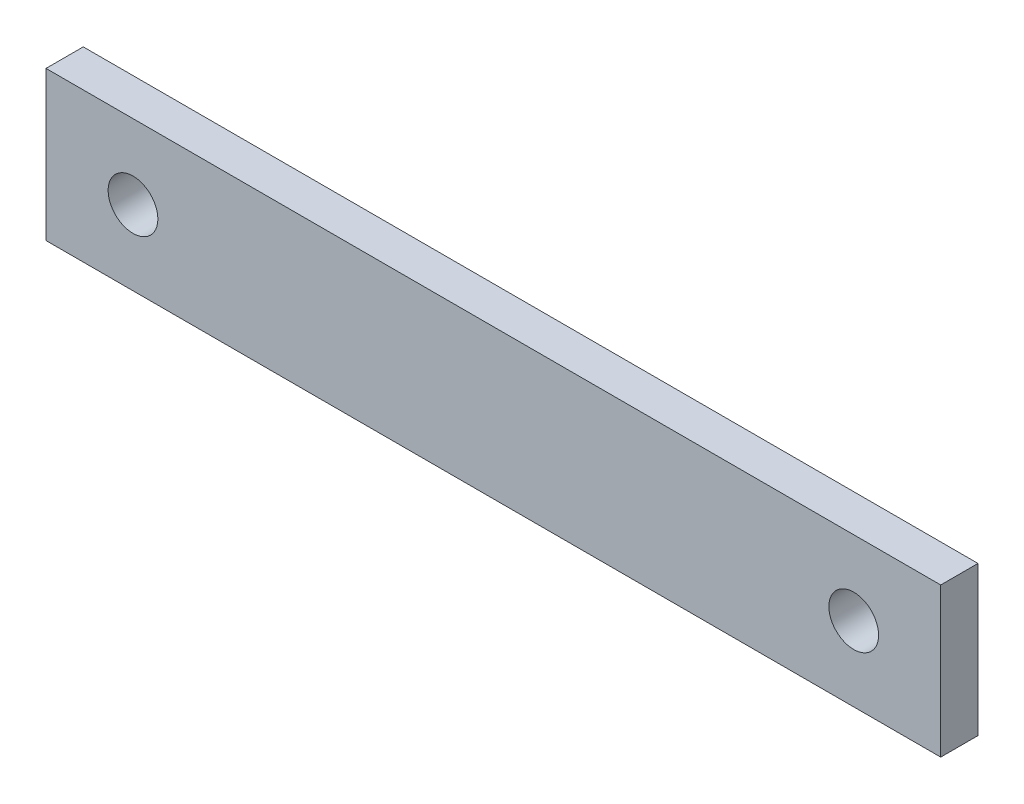
from build123d import *

# Parameters (mm, degrees)
ESQUISSE1_W             = 43.2
ESQUISSE1_H             = 7.2
BOSS_EXTRU_1_DEPTH      = 1.8
ESQUISSE2_R             = 1.2
ENL_V_MAT_EXTRU_1_DEPTH = 1.8


with BuildPart() as part:
    # Esquisse1 → Boss.-Extru.1 (new body)
    with BuildSketch(Plane.XY):
        with Locations((-2.995022473, 0.830769231)):
            Rectangle(ESQUISSE1_W, ESQUISSE1_H)
    extrude(amount=BOSS_EXTRU_1_DEPTH)

    # Esquisse2 → Enlèv. mat.-Extru.1 (cut)
    with BuildSketch(Plane.XY):
        with Locations((14.404977527, 0.830769231)):
            Circle(ESQUISSE2_R)
        with Locations(Location((-20.395022473, 0.830769231, 0), (0, 0, 180))):
            Circle(ESQUISSE2_R)
    extrude(amount=ENL_V_MAT_EXTRU_1_DEPTH, mode=Mode.SUBTRACT)


solid = part.part
